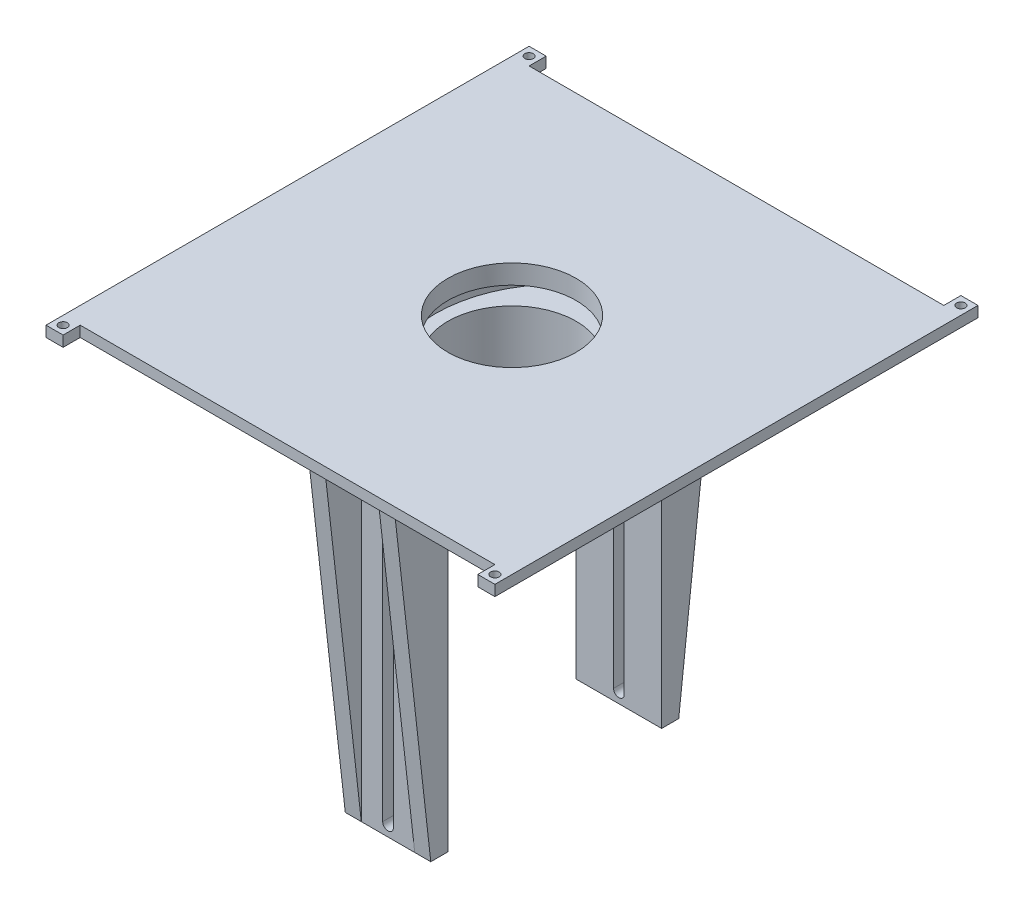
from build123d import *

# Parameters (mm, degrees)
SKETCH4_W                      = 116
SKETCH4_H                      = 116
BOSS_EXTRUDE1_DEPTH            = 4
SKETCH6_R                      = 30
CUT_EXTRUDE1_DEPTH             = 83.121860671
BOSS_EXTRUDE3_DEPTH            = 8.4
SKETCH10_W                     = 116
SKETCH10_H                     = 116
BOSS_EXTRUDE5_DEPTH            = 15
SKETCH11_R                     = 4
POSITIONING_HOLE_DEPTH         = 26
SKETCH23_R                     = 4
SNAPPING_HOLE_DEPTH            = 26
SKETCH13_R                     = 31.25
SKETCH13_R_2                   = 30
BOSS_EXTRUDE6_DEPTH            = 25
SKETCH24_W                     = 40
SKETCH24_H                     = 8
BOSS_EXTRUDE7_DEPTH            = 150
BOSS_EXTRUDE9_DEPTH            = 40
CUT_EXTRUDE6_DEPTH             = 8
CUT_EXTRUDE6_DIRECTION_2_REACH = 229.876
CUT_EXTRUDE7_REACH             = 225.194
CUT_EXTRUDE9_REACH             = 204.284
SKETCH37_W                     = 25
SKETCH37_H                     = 20
SKETCH41_W                     = 210
SKETCH41_H                     = 210
BOSS_EXTRUDE11_DEPTH           = 5
SKETCH12_R                     = 30
MAIN_HOLE_DEPTH                = 212.068709192
SKETCH43_W                     = 8
SKETCH43_H                     = 8
SKETCH43_R                     = 2
BOSS_EXTRUDE12_DEPTH           = 5


with BuildPart() as part:
    # Sketch4 → Boss-Extrude1 (new body)
    with BuildSketch(Plane(origin=(0, 0, 0), x_dir=(1, 0, 0), z_dir=(0, 1, 0))):
        Rectangle(SKETCH4_W, SKETCH4_H)
    extrude(amount=BOSS_EXTRUDE1_DEPTH)

    # Sketch6 → Cut-Extrude1 (cut, through all)
    with BuildSketch(Plane(origin=(0, 4, 0), x_dir=(1, 0, 0), z_dir=(0, 1, 0))):
        with Locations(Location((0, 0, 0), (0, 0, 270))):
            Circle(SKETCH6_R)
    extrude(amount=-CUT_EXTRUDE1_DEPTH, mode=Mode.SUBTRACT)

    # Sketch8 → Boss-Extrude3 (add)
    with BuildSketch(Plane.XZ):
        with BuildLine():
            Line((-58, 58), (-58, -58))
            Line((-58, -58), (22, -58))
            ThreePointArc((22, -58), (-36, 0), (22, 58))
            Line((22, 58), (-58, 58))
        make_face()
    extrude(amount=BOSS_EXTRUDE3_DEPTH)

    # Sketch10 → Boss-Extrude5 (add)
    with BuildSketch(Plane.XZ.offset(8.4)):
        Rectangle(SKETCH10_W, SKETCH10_H)
    extrude(amount=BOSS_EXTRUDE5_DEPTH)

    # Sketch11 → positioning hole (cut)
    with BuildSketch(Plane.XZ.offset(23.4)):
        with Locations(Location((39, 0, 0), (0, 0, 270))):
            Circle(SKETCH11_R)
    extrude(amount=-POSITIONING_HOLE_DEPTH, mode=Mode.SUBTRACT)

    # Sketch23 → snapping hole (cut)
    with BuildSketch(Plane.XZ.offset(23.4)):
        with Locations(Location((38.947036647, 20, 0), (0, 0, 270))):
            Circle(SKETCH23_R)
    extrude(amount=-SNAPPING_HOLE_DEPTH, mode=Mode.SUBTRACT)

    # Sketch13 → Boss-Extrude6 (add)
    with BuildSketch(Plane.XZ.offset(23.4)):
        with Locations(Location((0, 0, 0), (0, 0, 270))):
            Circle(SKETCH13_R)
        with Locations(Location((0, 0, 0), (0, 0, 90))):
            Circle(SKETCH13_R_2, mode=Mode.SUBTRACT)
    extrude(amount=BOSS_EXTRUDE6_DEPTH)

    # Sketch24 → Boss-Extrude7 (add)
    with BuildSketch(Plane.XZ.offset(23.4)):
        with Locations((0, 54)):
            Rectangle(SKETCH24_W, SKETCH24_H)
        with Locations((0, -54)):
            Rectangle(SKETCH24_W, SKETCH24_H)
    extrude(amount=BOSS_EXTRUDE7_DEPTH)

    # Sketch28 → Boss-Extrude9 (add)
    with BuildSketch(Plane.ZY.offset(20)):
        Polygon((-58, -173.4), (-58, 4), (-78, 4), align=None)
        Polygon((58, 4), (58, -173.4), (78, 4), align=None)
    extrude(amount=-BOSS_EXTRUDE9_DEPTH)

    # Sketch31 → Cut-Extrude6 (cut)
    with BuildSketch(Plane(origin=(0, 0, -58), x_dir=(-1, 0, 0), z_dir=(0, 0, -1))):
        with BuildLine():
            Line((2.5, -28.4), (2.5, -168.4))
            ThreePointArc((2.5, -168.4), (0, -170.9), (-2.5, -168.4))
            Line((-2.5, -168.4), (-2.5, -28.4))
            ThreePointArc((-2.5, -28.4), (0, -25.9), (2.5, -28.4))
        make_face()
    extrude(amount=-CUT_EXTRUDE6_DEPTH, mode=Mode.SUBTRACT)

    # Cut-Extrude6 direction 2: up to this plane
    cut_extrude6_direction_2_end = Plane(origin=(20, 4, -78), z_dir=(0, -0.11202985805393491, -0.9937048409384023))
    # Sketch31 → Cut-Extrude6 direction 2 (cut, up to the surface)
    with BuildSketch(Plane(origin=(0, 0, -58), x_dir=(-1, 0, 0), z_dir=(0, 0, -1)), mode=Mode.PRIVATE) as cut_extrude6_direction_2_sk1:
        with BuildLine():
            Line((2.5, -28.4), (2.5, -168.4))
            ThreePointArc((2.5, -168.4), (0, -170.9), (-2.5, -168.4))
            Line((-2.5, -168.4), (-2.5, -28.4))
            ThreePointArc((-2.5, -28.4), (0, -25.9), (2.5, -28.4))
        make_face()
    cut_extrude6_direction_2_tool1 = split(extrude(cut_extrude6_direction_2_sk1.sketch, amount=CUT_EXTRUDE6_DIRECTION_2_REACH, mode=Mode.PRIVATE), bisect_by=cut_extrude6_direction_2_end, keep=Keep.BOTH, mode=Mode.PRIVATE)
    add(cut_extrude6_direction_2_tool1.solids().sort_by_distance((0, -98.4, -58))[0], mode=Mode.SUBTRACT)

    # Cut-Extrude7: up to this plane
    cut_extrude7_end = Plane(origin=(20, -173.4, 58), z_dir=(0, -0.11202985805393491, 0.9937048409384023))
    # Sketch34 → Cut-Extrude7 (cut, up to the surface)
    with BuildSketch(Plane(origin=(0, 0, 50), x_dir=(-1, 0, 0), z_dir=(0, 0, -1)), mode=Mode.PRIVATE) as cut_extrude7_sk1:
        with BuildLine():
            Line((-2.5, -28.4), (-2.5, -168.4))
            ThreePointArc((-2.5, -168.4), (0, -170.9), (2.5, -168.4))
            Line((2.5, -168.4), (2.5, -28.4))
            ThreePointArc((2.5, -28.4), (0, -25.9), (-2.5, -28.4))
        make_face()
    cut_extrude7_tool1 = split(extrude(cut_extrude7_sk1.sketch, amount=-CUT_EXTRUDE7_REACH, mode=Mode.PRIVATE), bisect_by=cut_extrude7_end, keep=Keep.BOTH, mode=Mode.PRIVATE)
    add(cut_extrude7_tool1.solids().sort_by_distance((0, -98.4, 50))[0], mode=Mode.SUBTRACT)

    # Sketch37 → Cut-Extrude9 (cut, up to next)
    with BuildSketch(Plane(origin=(0, 4, 0), x_dir=(1, 0, 0), z_dir=(0, 1, 0)), mode=Mode.PRIVATE) as cut_extrude9_sk1:
        with Locations((0, 68)):
            Rectangle(SKETCH37_W, SKETCH37_H)
    cut_extrude9_tool1 = extrude(cut_extrude9_sk1.sketch, amount=-CUT_EXTRUDE9_REACH, mode=Mode.PRIVATE) & part.part
    # Sketch37 → Cut-Extrude9 (cut, up to next)
    with BuildSketch(Plane(origin=(0, 4, 0), x_dir=(1, 0, 0), z_dir=(0, 1, 0)), mode=Mode.PRIVATE) as cut_extrude9_sk2:
        with Locations((0, -68)):
            Rectangle(SKETCH37_W, SKETCH37_H)
    cut_extrude9_tool2 = extrude(cut_extrude9_sk2.sketch, amount=-CUT_EXTRUDE9_REACH, mode=Mode.PRIVATE) & part.part
    add(cut_extrude9_tool1.solids().sort_by_distance((0, 4, -68))[0], mode=Mode.SUBTRACT)
    add(cut_extrude9_tool2.solids().sort_by_distance((0, 4, 68))[0], mode=Mode.SUBTRACT)

    # Sketch41 → Boss-Extrude11 (add)
    with BuildSketch(Plane(origin=(0, 4, 0), x_dir=(1, 0, 0), z_dir=(0, 1, 0))):
        Rectangle(SKETCH41_W, SKETCH41_H)
    extrude(amount=BOSS_EXTRUDE11_DEPTH)

    # Sketch12 → main hole (cut, through all)
    with BuildSketch(Plane.XZ.offset(23.4)):
        with Locations(Location((0, 0, 0), (0, 0, 90))):
            Circle(SKETCH12_R)
    extrude(amount=-MAIN_HOLE_DEPTH, mode=Mode.SUBTRACT)

    # Sketch43 → Boss-Extrude12 (add)
    # profile 1 of 4: a face of its own
    with BuildSketch(Plane(origin=(0, 9, 0), x_dir=(1, 0, 0), z_dir=(0, 1, 0))):
        with Locations((101, 109)):
            Rectangle(SKETCH43_W, SKETCH43_H)
        with Locations(Location((101, 109, 0), (0, 0, 270))):
            Circle(SKETCH43_R, mode=Mode.SUBTRACT)
    # profile 2 of 4: a face of its own
    with BuildSketch(Plane(origin=(0, 9, 0), x_dir=(1, 0, 0), z_dir=(0, 1, 0))):
        with Locations((-101, 109)):
            Rectangle(SKETCH43_W, SKETCH43_H)
        with Locations(Location((-101, 109, 0), (0, 0, 270))):
            Circle(SKETCH43_R, mode=Mode.SUBTRACT)
    # profile 3 of 4: a face of its own
    with BuildSketch(Plane(origin=(0, 9, 0), x_dir=(1, 0, 0), z_dir=(0, 1, 0))):
        with Locations((-101, -109)):
            Rectangle(SKETCH43_W, SKETCH43_H)
        with Locations(Location((-101, -109, 0), (0, 0, 90))):
            Circle(SKETCH43_R, mode=Mode.SUBTRACT)
    # profile 4 of 4: a face of its own
    with BuildSketch(Plane(origin=(0, 9, 0), x_dir=(1, 0, 0), z_dir=(0, 1, 0))):
        with Locations((101, -109)):
            Rectangle(SKETCH43_W, SKETCH43_H)
        with Locations(Location((101, -109, 0), (0, 0, 90))):
            Circle(SKETCH43_R, mode=Mode.SUBTRACT)
    extrude(amount=-BOSS_EXTRUDE12_DEPTH)


solid = part.part
